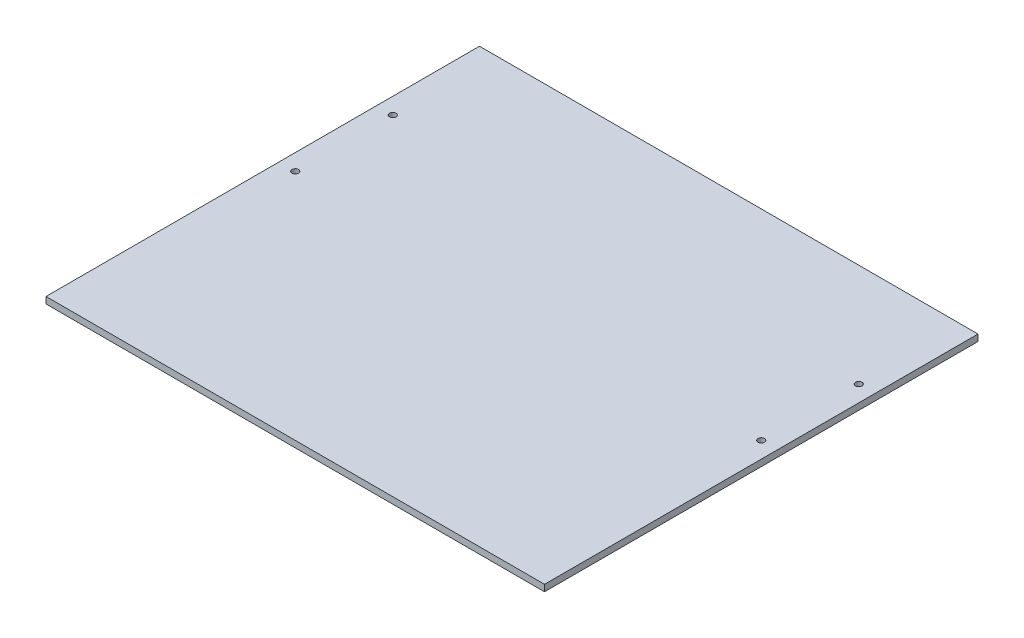
from build123d import *

# Parameters (mm, degrees)
ESBO_O1_W                = 230
ESBO_O1_H                = 200
ESBO_O1_R                = 1.5
RESSALTO_EXTRUS_O1_DEPTH = 3


with BuildPart() as part:
    # Esboço1 → Ressalto-extrusão1 (new body)
    with BuildSketch(Plane(origin=(0, 0, 0), x_dir=(1, 0, 0), z_dir=(0, 1, 0))):
        Rectangle(ESBO_O1_W, ESBO_O1_H)
        with Locations(Location((-107.5, 52.5, 0), (0, 0, 270))):
            Circle(ESBO_O1_R, mode=Mode.SUBTRACT)
        with Locations(Location((-107.5, 7.5, 0), (0, 0, 270))):
            Circle(ESBO_O1_R, mode=Mode.SUBTRACT)
        with Locations(Location((107.5, 7.5, 0), (0, 0, 90))):
            Circle(ESBO_O1_R, mode=Mode.SUBTRACT)
        with Locations(Location((107.5, 52.5, 0), (0, 0, 90))):
            Circle(ESBO_O1_R, mode=Mode.SUBTRACT)
    extrude(amount=RESSALTO_EXTRUS_O1_DEPTH)


solid = part.part
